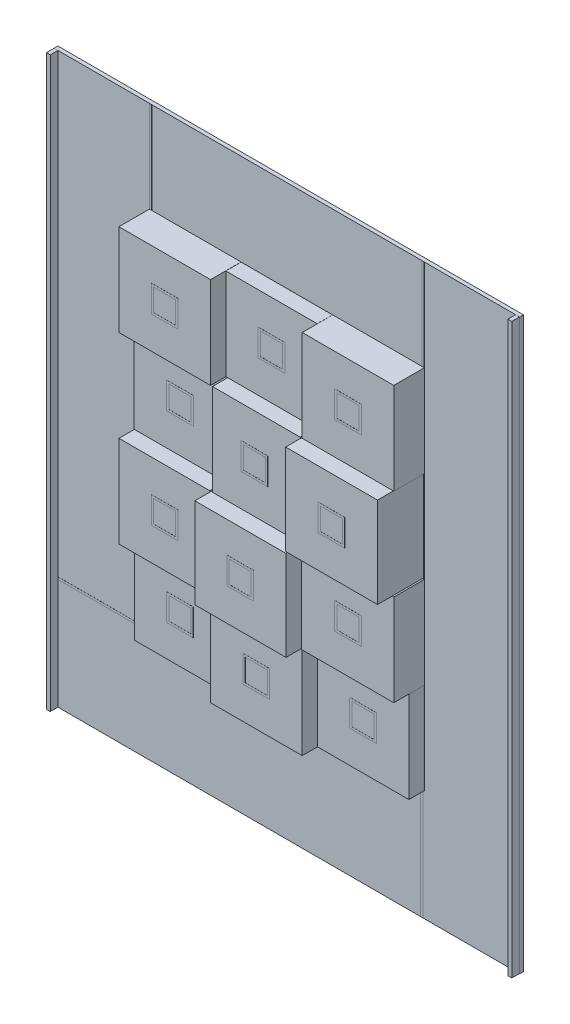
from build123d import *

# Parameters (mm, degrees)
SKETCH1_W            = 6100
SKETCH1_H            = 7450
BOSS_EXTRUDE1_DEPTH  = 50
SKETCH5_W            = 3600
SKETCH5_H            = 4800
SKETCH5_W_2          = 3500
SKETCH5_H_2          = 4700
BOSS_EXTRUDE6_DEPTH  = 1
SKETCH7_W            = 1200
SKETCH7_H            = 1200
SKETCH7_W_2          = 1150
SKETCH7_W_3          = 1190
BOSS_EXTRUDE11_DEPTH = 400
SKETCH10_W           = 1193.3198667
SKETCH10_H           = 1184.29970219
BOSS_EXTRUDE13_DEPTH = 200
SKETCH11_W           = 1196.495766682
SKETCH11_H           = 1196.864955881
BOSS_EXTRUDE14_DEPTH = 200
SKETCH12_W           = 1216.789066574
SKETCH12_H           = 1195.770178284
SKETCH12_W_2         = 1196.503072031
SKETCH12_H_2         = 1198.253159093
BOSS_EXTRUDE15_DEPTH = 200
SKETCH14_W           = 1203.539627026
SKETCH14_H           = 1185.001739034
SKETCH14_W_2         = 1194.36727466
SKETCH14_H_2         = 1179.250706547
BOSS_EXTRUDE17_DEPTH = 600
SKETCH15_W           = 350
SKETCH15_H           = 350
SKETCH15_W_2         = 290
SKETCH15_H_2         = 290
BOSS_EXTRUDE18_DEPTH = 1
SKETCH16_W           = 350
SKETCH16_H           = 350
SKETCH16_W_2         = 290
SKETCH16_H_2         = 290
BOSS_EXTRUDE19_DEPTH = 1
SKETCH17_W           = 350
SKETCH17_H           = 350
SKETCH17_W_2         = 290
SKETCH17_H_2         = 290
BOSS_EXTRUDE20_DEPTH = 1
SKETCH18_W           = 350
SKETCH18_H           = 350
SKETCH18_W_2         = 290
SKETCH18_H_2         = 290
BOSS_EXTRUDE21_DEPTH = 1
SKETCH20_W           = 50
SKETCH20_H           = 7449.674301314
BOSS_EXTRUDE22_DEPTH = 100
SKETCH21_W           = 50
SKETCH21_H           = 7448.811212132
BOSS_EXTRUDE23_DEPTH = 100
SKETCH23_W           = 1199.004578623
SKETCH23_H           = 30
SKETCH23_W_2         = 30
SKETCH23_H_2         = 1449.350539651
SKETCH23_H_3         = 1199.93118009
SKETCH23_H_4         = 1199.995244662
BOSS_EXTRUDE25_DEPTH = 1


with BuildPart() as part:
    # Sketch1 → Boss-Extrude1 (new body)
    with BuildSketch(Plane.XY):
        with Locations((131.351351351, -375.855855856)):
            Rectangle(SKETCH1_W, SKETCH1_H)
    extrude(amount=BOSS_EXTRUDE1_DEPTH)

    # Sketch5 → Boss-Extrude6 (add)
    with BuildSketch(Plane.XY.offset(50)):
        with Locations((131.351351351, -250.855855856)):
            Rectangle(SKETCH5_W, SKETCH5_H)
        with Locations((131.351351351, -250.855855856)):
            Rectangle(SKETCH5_W_2, SKETCH5_H_2, mode=Mode.SUBTRACT)
    extrude(amount=BOSS_EXTRUDE6_DEPTH)

    # Sketch7 → Boss-Extrude11 (add)
    with BuildSketch(Plane.XY.offset(50)):
        with Locations((-1068.648648649, 1549.144144144)):
            Rectangle(SKETCH7_W, SKETCH7_H)
        with Locations((1331.351351351, 1549.144144144)):
            Rectangle(SKETCH7_W, SKETCH7_H)
        with Locations((131.351351351, 349.144144144)):
            Rectangle(SKETCH7_W_2, SKETCH7_H)
        with Locations((-1073.648648649, -850.855855856)):
            Rectangle(SKETCH7_W_3, SKETCH7_H)
        Polygon((-468.648648649, -1450.855855856), (-468.648648649, -2650.855855856), (731.351351351, -2650.855855856), (731.351351351, -1450.855855856), (721.351351351, -1450.855855856), align=None)
        Polygon((1931.351351351, -1450.855855856), (1931.351351351, -250.855855856), (721.351351351, -250.855855856), (721.351351351, -1450.855855856), (731.351351351, -1450.855855856), align=None)
    extrude(amount=BOSS_EXTRUDE11_DEPTH)

    # Sketch10 → Boss-Extrude13 (add)
    with BuildSketch(Plane.XY.offset(51)):
        with Locations((-1068.308581999, -2046.522337866)):
            Rectangle(SKETCH10_W, SKETCH10_H)
    extrude(amount=BOSS_EXTRUDE13_DEPTH)

    # Sketch11 → Boss-Extrude14 (add)
    with BuildSketch(Plane.XY.offset(51)):
        with Locations((1330.717016677, -2051.040883626)):
            Rectangle(SKETCH11_W, SKETCH11_H)
    extrude(amount=BOSS_EXTRUDE14_DEPTH)

    # Sketch12 → Boss-Extrude15 (add)
    with BuildSketch(Plane.XY.offset(51)):
        with Locations((-1059.449606636, 350.00746587)):
            Rectangle(SKETCH12_W, SKETCH12_H)
        with Locations((130.768886785, 1548.898792914)):
            Rectangle(SKETCH12_W_2, SKETCH12_H_2)
    extrude(amount=BOSS_EXTRUDE15_DEPTH)

    # Sketch14 → Boss-Extrude17 (add)
    with BuildSketch(Plane.XY.offset(51)):
        with Locations((1317.521986428, 350.206640842)):
            Rectangle(SKETCH14_W, SKETCH14_H)
        with Locations((123.534988681, -851.569555604)):
            Rectangle(SKETCH14_W_2, SKETCH14_H_2)
    extrude(amount=BOSS_EXTRUDE17_DEPTH)


with BuildPart() as boss_extrude17_piece_1:
    # of the separate pieces the step leaves, piece 1, a body of its own (boss_extrude17_pieces)
    add(part.part.solids().sort_by_distance((-2918.648648649, 3349.144144144, 0))[0])

    # Sketch15 → Boss-Extrude18 (add)
    with BuildSketch(Plane.XY.offset(450)):
        with Locations((-1068.648648649, 1547.892555012)):
            Rectangle(SKETCH15_W, SKETCH15_H)
        with Locations((-1068.648648649, 1547.892555012)):
            Rectangle(SKETCH15_W_2, SKETCH15_H_2, mode=Mode.SUBTRACT)
    extrude(amount=BOSS_EXTRUDE18_DEPTH)

    # Sketch16 → Boss-Extrude19 (add)
    # profile 1 of 5: a face of its own
    with BuildSketch(Plane.XY.offset(450)):
        with Locations((1331.351351351, 1549.144144144)):
            Rectangle(SKETCH16_W, SKETCH16_H)
        with Locations((1331.351351351, 1549.144144144)):
            Rectangle(SKETCH16_W_2, SKETCH16_H_2, mode=Mode.SUBTRACT)
    # profile 2 of 5: a face of its own
    with BuildSketch(Plane.XY.offset(450)):
        with Locations((106.351351351, 349.144144144)):
            Rectangle(SKETCH16_W, SKETCH16_H)
        with Locations((106.351351351, 349.144144144)):
            Rectangle(SKETCH16_W_2, SKETCH16_H_2, mode=Mode.SUBTRACT)
    # profile 3 of 5: a face of its own
    with BuildSketch(Plane.XY.offset(450)):
        with Locations((1331.351351351, -850.855855856)):
            Rectangle(SKETCH16_W, SKETCH16_H)
        with Locations((1331.351351351, -850.855855856)):
            Rectangle(SKETCH16_W_2, SKETCH16_H_2, mode=Mode.SUBTRACT)
    # profile 4 of 5: a face of its own
    with BuildSketch(Plane.XY.offset(450)):
        with Locations((131.351351351, -2050.855855856)):
            Rectangle(SKETCH16_W, SKETCH16_H)
        with Locations((131.351351351, -2050.855855856)):
            Rectangle(SKETCH16_W_2, SKETCH16_H_2, mode=Mode.SUBTRACT)
    # profile 5 of 5: a face of its own
    with BuildSketch(Plane.XY.offset(450)):
        with Locations((-1068.648648649, -850.855855856)):
            Rectangle(SKETCH16_W, SKETCH16_H)
        with Locations((-1068.648648649, -850.855855856)):
            Rectangle(SKETCH16_W_2, SKETCH16_H_2, mode=Mode.SUBTRACT)
    extrude(amount=BOSS_EXTRUDE19_DEPTH)

    # Sketch17 → Boss-Extrude20 (add)
    # profile 1 of 4: a face of its own
    with BuildSketch(Plane.XY.offset(251)):
        with Locations((132.51735077, 1549.144144144)):
            Rectangle(SKETCH17_W, SKETCH17_H)
        with Locations((132.51735077, 1549.144144144)):
            Rectangle(SKETCH17_W_2, SKETCH17_H_2, mode=Mode.SUBTRACT)
    # profile 2 of 4: a face of its own
    with BuildSketch(Plane.XY.offset(251)):
        with Locations((-1067.844139923, 349.144144144)):
            Rectangle(SKETCH17_W, SKETCH17_H)
        with Locations((-1067.844139923, 349.144144144)):
            Rectangle(SKETCH17_W_2, SKETCH17_H_2, mode=Mode.SUBTRACT)
    # profile 3 of 4: a face of its own
    with BuildSketch(Plane.XY.offset(251)):
        with Locations((-1068.648648649, -2050.855855856)):
            Rectangle(SKETCH17_W, SKETCH17_H)
        with Locations((-1068.648648649, -2050.855855856)):
            Rectangle(SKETCH17_W_2, SKETCH17_H_2, mode=Mode.SUBTRACT)
    # profile 4 of 4: a face of its own
    with BuildSketch(Plane.XY.offset(251)):
        with Locations((1331.351351351, -2050.855855856)):
            Rectangle(SKETCH17_W, SKETCH17_H)
        with Locations((1331.351351351, -2050.855855856)):
            Rectangle(SKETCH17_W_2, SKETCH17_H_2, mode=Mode.SUBTRACT)
    extrude(amount=BOSS_EXTRUDE20_DEPTH)



with BuildPart() as boss_extrude17_piece_2:
    # of the separate pieces the step leaves, piece 2, a body of its own (boss_extrude17_pieces)
    add(part.part.solids().sort_by_distance((720.718626011, -261.94420233, 51))[0])


with BuildPart() as boss_extrude17_piece_1_1:
    add(boss_extrude17_piece_1.part)

    add(boss_extrude17_piece_2.part)  # Boss-Extrude21 merges Boss-Extrude17 piece 2
    # Sketch18 → Boss-Extrude21 (add)
    # profile 1 of 2: a face of its own
    with BuildSketch(Plane.XY.offset(651)):
        with Locations((121.351351351, -841.194908877)):
            Rectangle(SKETCH18_W, SKETCH18_H)
        with Locations((121.351351351, -841.194908877)):
            Rectangle(SKETCH18_W_2, SKETCH18_H_2, mode=Mode.SUBTRACT)
    # profile 2 of 2: a face of its own
    with BuildSketch(Plane.XY.offset(651)):
        with Locations((1315.752172915, 357.705771325)):
            Rectangle(SKETCH18_W, SKETCH18_H)
        with Locations((1315.752172915, 357.705771325)):
            Rectangle(SKETCH18_W_2, SKETCH18_H_2, mode=Mode.SUBTRACT)
    extrude(amount=BOSS_EXTRUDE21_DEPTH)

    # Sketch20 → Boss-Extrude22 (add)
    with BuildSketch(Plane.XY.offset(50)):
        with Locations((-2893.382539233, -375.929585143)):
            Rectangle(SKETCH20_W, SKETCH20_H)
    extrude(amount=BOSS_EXTRUDE22_DEPTH)

    # Sketch21 → Boss-Extrude23 (add)
    with BuildSketch(Plane.XY.offset(50)):
        with Locations((3151.837698566, -376.053796635)):
            Rectangle(SKETCH21_W, SKETCH21_H)
    extrude(amount=BOSS_EXTRUDE23_DEPTH)

    # Sketch23 → Boss-Extrude25 (add)
    with BuildSketch(Plane.XY.offset(50)):
        with Locations((-2268.41691332, -2635.885740052)):
            Rectangle(SKETCH23_W, SKETCH23_H)
        with Locations((1898.78531362, -3375.635381433)):
            Rectangle(SKETCH23_W_2, SKETCH23_H_2)
        with Locations((-1653.653815139, 2749.14402507)):
            Rectangle(SKETCH23_W_2, SKETCH23_H_3)
        with Locations((1916.351351351, 2749.141766475)):
            Rectangle(SKETCH23_W_2, SKETCH23_H_4)
    extrude(amount=BOSS_EXTRUDE25_DEPTH)


solid = boss_extrude17_piece_1_1.part
